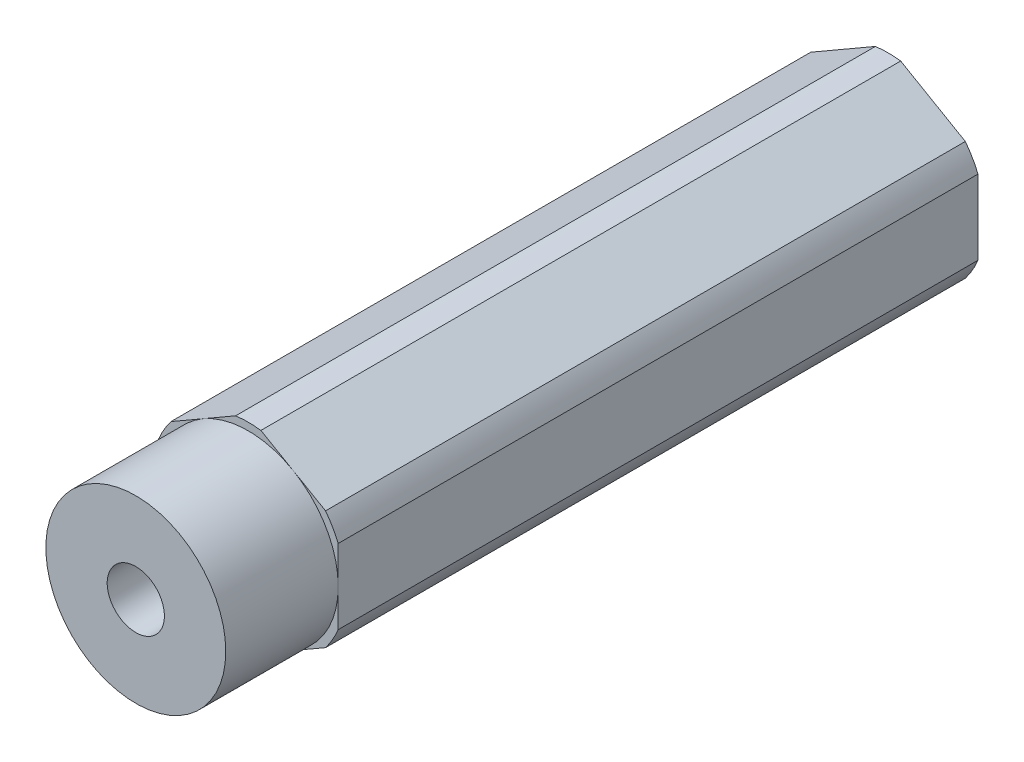
from build123d import *

# Parameters (mm, degrees)
SKETCH1_R                            = 2.0193
BOSS_EXTRUDE1_DEPTH                  = 26.549999986
F_10_32_TAPPED_HOLE1_D               = 4.0386
F_10_32_TAPPED_HOLE1_DEPTH           = 12.02944
F_10_32_TAPPED_HOLE1_TIP             = 1.213317848
F_10_32_TAPPED_HOLE1_ON_FACE_2_D     = 4.0386
F_10_32_TAPPED_HOLE1_ON_FACE_2_DEPTH = 12.02944
F_10_32_TAPPED_HOLE1_ON_FACE_2_TIP   = 1.213317848
SKETCH5_R                            = 6.874999966
SKETCH5_R_2                          = 6.35
CUT_EXTRUDE1_DEPTH                   = 7.9375


with BuildPart() as part:
    # Sketch1 → Boss-Extrude1 (new, symmetric)
    with BuildSketch(Plane.XY):
        with BuildLine():
            ThreePointArc((0.893039571, 6.816751782), (0, 6.874999966), (-0.893039571, 6.816751782))
            Line((-0.893039571, 6.816751782), (-5.456960429, 4.181770846))
            ThreePointArc((-5.456960429, 4.181770846), (-5.953924622, 3.437499983), (-6.35, 2.634980936))
            Line((-6.35, 2.634980936), (-6.35, -2.634980936))
            ThreePointArc((-6.35, -2.634980936), (-5.953924622, -3.437499983), (-5.456960429, -4.181770846))
            Line((-5.456960429, -4.181770846), (-0.893039571, -6.816751782))
            ThreePointArc((-0.893039571, -6.816751782), (0, -6.874999966), (0.893039571, -6.816751782))
            Line((0.893039571, -6.816751782), (5.456960429, -4.181770846))
            ThreePointArc((5.456960429, -4.181770846), (5.953924622, -3.437499983), (6.35, -2.634980936))
            Line((6.35, -2.634980936), (6.35, 2.634980936))
            ThreePointArc((6.35, 2.634980936), (5.953924622, 3.437499983), (5.456960429, 4.181770846))
            Line((5.456960429, 4.181770846), (0.893039571, 6.816751782))
        make_face()
        Circle(SKETCH1_R, mode=Mode.SUBTRACT)
    extrude(amount=BOSS_EXTRUDE1_DEPTH, both=True)

    # #10-32 Tapped Hole1
    with Locations(Plane.XY.offset(26.549999986)):
        with Locations((0, 0)):
            Hole(F_10_32_TAPPED_HOLE1_D / 2, depth=F_10_32_TAPPED_HOLE1_DEPTH)
            with Locations((0, 0, -(F_10_32_TAPPED_HOLE1_DEPTH + F_10_32_TAPPED_HOLE1_TIP / 2))):  # 118° drill point
                Cone(0, F_10_32_TAPPED_HOLE1_D / 2, F_10_32_TAPPED_HOLE1_TIP, mode=Mode.SUBTRACT)

    # #10-32 Tapped Hole1 on face 2
    with Locations(Plane.XY.offset(-26.549999986)):
        with Locations((0, 0)):
            Hole(F_10_32_TAPPED_HOLE1_ON_FACE_2_D / 2, depth=F_10_32_TAPPED_HOLE1_ON_FACE_2_DEPTH)
            with Locations((0, 0, -(F_10_32_TAPPED_HOLE1_ON_FACE_2_DEPTH + F_10_32_TAPPED_HOLE1_ON_FACE_2_TIP / 2))):  # 118° drill point
                Cone(0, F_10_32_TAPPED_HOLE1_ON_FACE_2_D / 2, F_10_32_TAPPED_HOLE1_ON_FACE_2_TIP, mode=Mode.SUBTRACT)

    # Sketch5 → Cut-Extrude1 (cut)
    with BuildSketch(Plane.XY.offset(26.549999986)):
        Circle(SKETCH5_R)
        Circle(SKETCH5_R_2, mode=Mode.SUBTRACT)
    extrude(amount=-CUT_EXTRUDE1_DEPTH, mode=Mode.SUBTRACT)


solid = part.part
